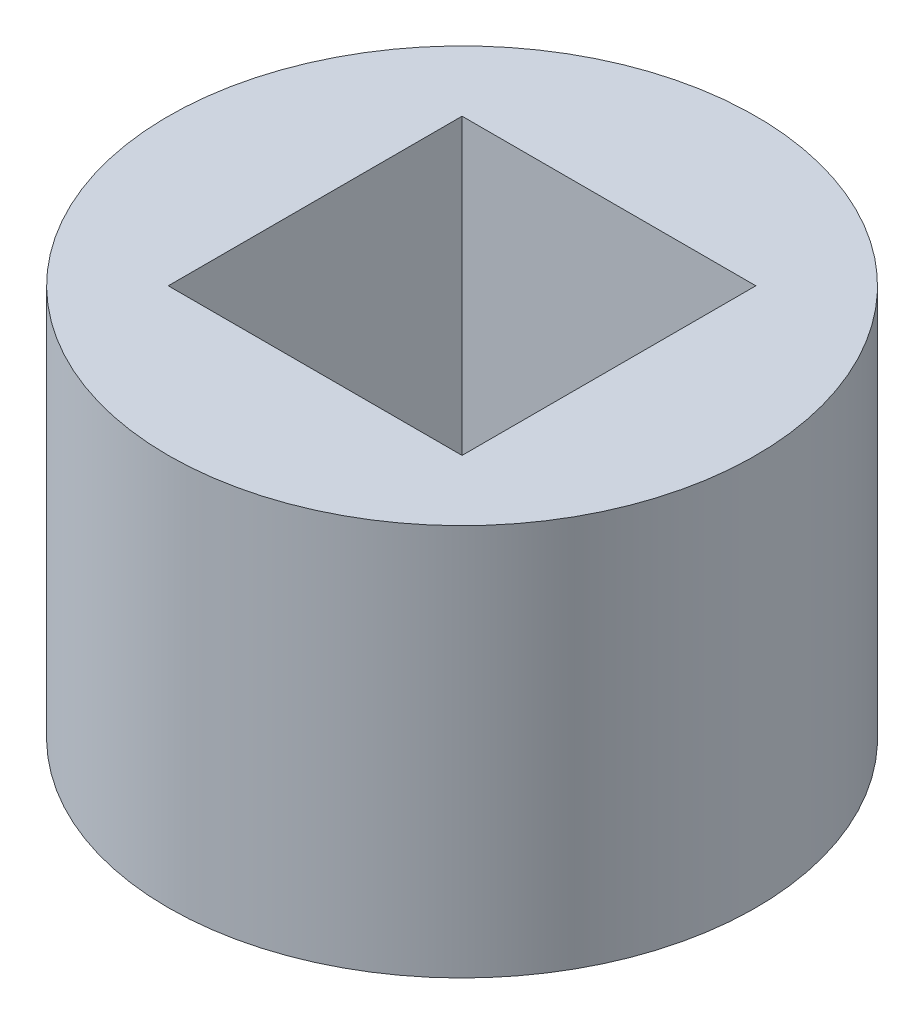
from build123d import *

# Parameters (mm, degrees)
SKETCH_2_R      = 15
SKETCH_2_W      = 15
SKETCH_2_H      = 15
EXTRUDE_1_DEPTH = 20


with BuildPart() as part:
    # 草图2 → 凸台-拉伸1 (new body)
    with BuildSketch(Plane(origin=(0, 0, 0), x_dir=(1, 0, 0), z_dir=(0, 1, 0))):
        with Locations(Location((0, 0, 0), (0, 0, 270))):
            Circle(SKETCH_2_R)
        Rectangle(SKETCH_2_W, SKETCH_2_H, mode=Mode.SUBTRACT)
    extrude(amount=EXTRUDE_1_DEPTH)


solid = part.part
